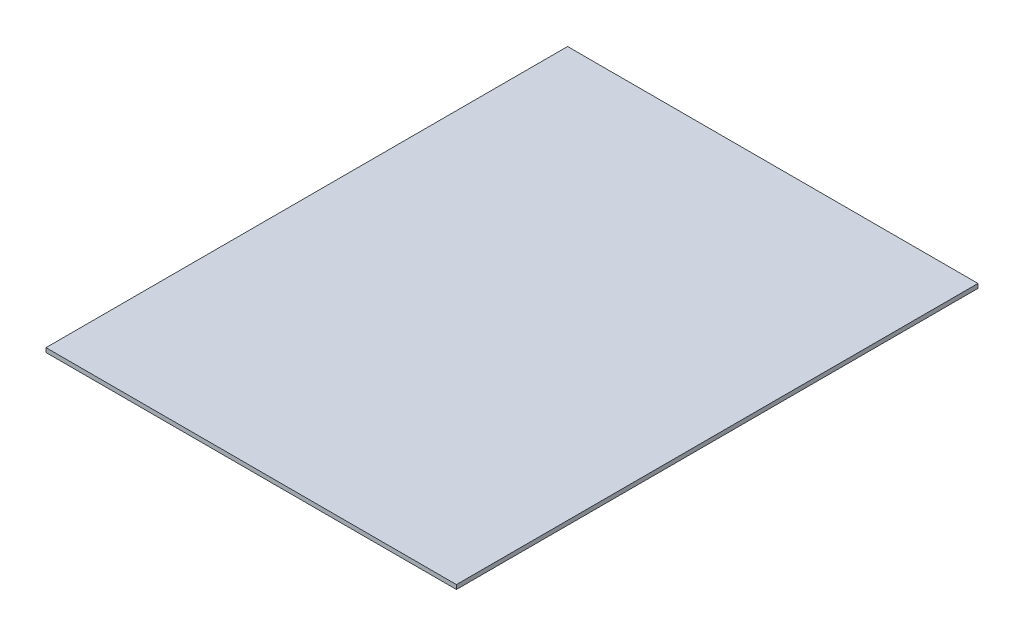
from build123d import *

# Parameters (mm, degrees)
SKETCH1_W           = 304.8
SKETCH1_H           = 387.35
BOSS_EXTRUDE1_DEPTH = 3.175


with BuildPart() as part:
    # Sketch1 → Boss-Extrude1 (new body)
    with BuildSketch(Plane(origin=(0, 0, 0), x_dir=(1, 0, 0), z_dir=(0, 1, 0))):
        Rectangle(SKETCH1_W, SKETCH1_H)
    extrude(amount=BOSS_EXTRUDE1_DEPTH)


solid = part.part
